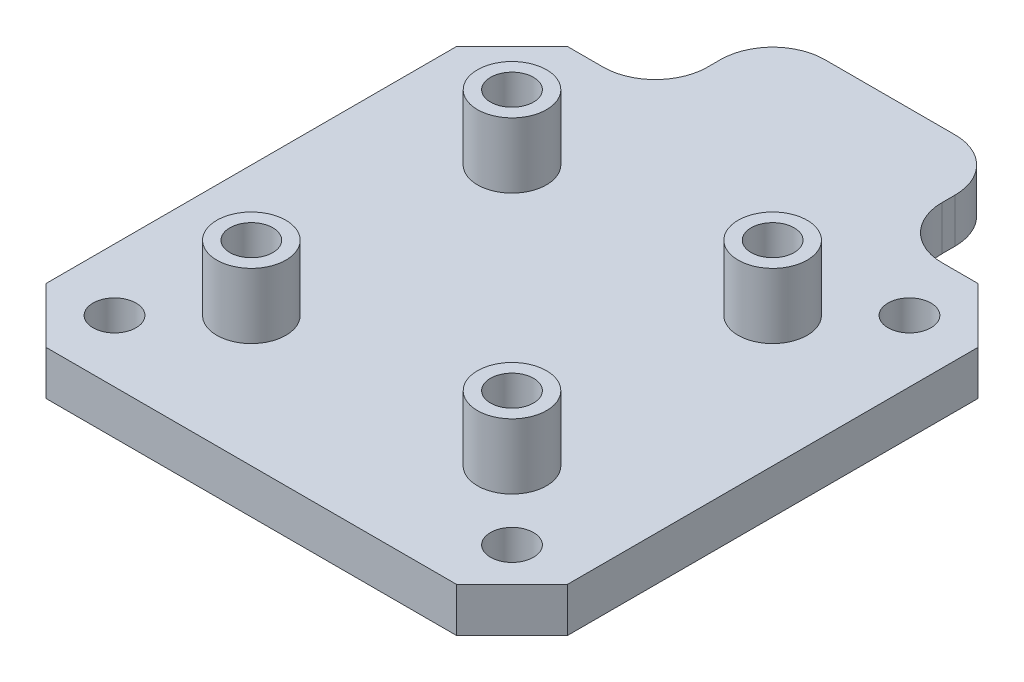
from build123d import *

# Parameters (mm, degrees)
BOSS_EXTRUDE1_DEPTH = 1.7
SKETCH2_R           = 1.65
CUT_EXTRUDE1_DEPTH  = 3.4
BOSS_EXTRUDE2_START = 5
SKETCH3_R           = 2.65
SKETCH3_R_2         = 1.65
BOSS_EXTRUDE2_DEPTH = 5
CUT_EXTRUDE2_START  = -0.5
CUT_EXTRUDE2_DEPTH  = 2.4


with BuildPart() as part:
    # Sketch1 → Boss-Extrude1 (new, symmetric)
    with BuildSketch(Plane(origin=(0, 0, 0), x_dir=(1, 0, 0), z_dir=(0, 1, 0))):
        with BuildLine():
            Line((-13, 20), (-15.757359313, 20))
            Line((-15.757359313, 20), (-20, 15.757359313))
            Line((-20, 15.757359313), (-20, -15.757359313))
            Line((-20, -15.757359313), (-15.757359313, -20))
            Line((-15.757359313, -20), (15.757359313, -20))
            Line((15.757359313, -20), (20, -15.757359313))
            Line((20, -15.757359313), (20, 15.757359313))
            Line((20, 15.757359313), (15.757359313, 20))
            Line((15.757359313, 20), (13, 20))
            ThreePointArc((13, 20), (10.171572875, 21.171572875), (9, 24))
            Line((9, 24), (9, 25))
            ThreePointArc((9, 25), (7.828427125, 27.828427125), (5, 29))
            Line((5, 29), (-5, 29))
            ThreePointArc((-5, 29), (-7.828427125, 27.828427125), (-9, 25))
            Line((-9, 25), (-9, 24))
            ThreePointArc((-9, 24), (-10.171572875, 21.171572875), (-13, 20))
        make_face()
    extrude(amount=BOSS_EXTRUDE1_DEPTH, both=True)

    # Sketch2 → Cut-Extrude1 (cut)
    with BuildSketch(Plane(origin=(0, 1.7, 0), x_dir=(1, 0, 0), z_dir=(0, 1, 0))):
        with Locations(Location((-10, 10, 0), (0, 0, 270))):
            Circle(SKETCH2_R)
        with Locations(Location((10, 10, 0), (0, 0, 270))):
            Circle(SKETCH2_R)
        with Locations(Location((-10, -10, 0), (0, 0, 270))):
            Circle(SKETCH2_R)
        with Locations(Location((10, -10, 0), (0, 0, 270))):
            Circle(SKETCH2_R)
        with Locations(Location((-15.25, -15.25, 0), (0, 0, 270))):
            Circle(SKETCH2_R)
        with Locations(Location((-15.25, 15.25, 0), (0, 0, 270))):
            Circle(SKETCH2_R)
        with Locations(Location((15.25, 15.25, 0), (0, 0, 270))):
            Circle(SKETCH2_R)
        with Locations(Location((15.25, -15.25, 0), (0, 0, 270))):
            Circle(SKETCH2_R)
    extrude(amount=-CUT_EXTRUDE1_DEPTH, mode=Mode.SUBTRACT)

    # Sketch3 → Boss-Extrude2 (add)
    # profile 1 of 4: a face of its own
    with BuildSketch(Plane(origin=(0, 1.7, 0), x_dir=(1, 0, 0), z_dir=(0, 1, 0)).offset(BOSS_EXTRUDE2_START)):
        with Locations(Location((-10, 10, 0), (0, 0, 270))):
            Circle(SKETCH3_R)
        with Locations(Location((-10, 10, 0), (0, 0, 270))):
            Circle(SKETCH3_R_2, mode=Mode.SUBTRACT)
    # profile 2 of 4: a face of its own
    with BuildSketch(Plane(origin=(0, 1.7, 0), x_dir=(1, 0, 0), z_dir=(0, 1, 0)).offset(BOSS_EXTRUDE2_START)):
        with Locations(Location((10, 10, 0), (0, 0, 270))):
            Circle(SKETCH3_R)
        with Locations(Location((10, 10, 0), (0, 0, 270))):
            Circle(SKETCH3_R_2, mode=Mode.SUBTRACT)
    # profile 3 of 4: a face of its own
    with BuildSketch(Plane(origin=(0, 1.7, 0), x_dir=(1, 0, 0), z_dir=(0, 1, 0)).offset(BOSS_EXTRUDE2_START)):
        with Locations(Location((10, -10, 0), (0, 0, 270))):
            Circle(SKETCH3_R)
        with Locations(Location((10, -10, 0), (0, 0, 270))):
            Circle(SKETCH3_R_2, mode=Mode.SUBTRACT)
    # profile 4 of 4: a face of its own
    with BuildSketch(Plane(origin=(0, 1.7, 0), x_dir=(1, 0, 0), z_dir=(0, 1, 0)).offset(BOSS_EXTRUDE2_START)):
        with Locations(Location((-10, -10, 0), (0, 0, 270))):
            Circle(SKETCH3_R)
        with Locations(Location((-10, -10, 0), (0, 0, 270))):
            Circle(SKETCH3_R_2, mode=Mode.SUBTRACT)
    extrude(amount=-BOSS_EXTRUDE2_DEPTH)

    # Sketch4 → Cut-Extrude2 (cut)
    with BuildSketch(Plane(origin=(0, 1.7, 0), x_dir=(1, 0, 0), z_dir=(0, 1, 0)).offset(CUT_EXTRUDE2_START)):
        Polygon((-6.709103466, 10), (-8.354551733, 12.85), (-11.645448267, 12.85), (-13.290896534, 10), (-11.645448267, 7.15), (-8.354551733, 7.15), align=None)
        Polygon((13.290896534, 10), (11.645448267, 12.85), (8.354551733, 12.85), (6.709103466, 10), (8.354551733, 7.15), (11.645448267, 7.15), align=None)
        Polygon((13.290896534, -10), (11.645448267, -7.15), (8.354551733, -7.15), (6.709103466, -10), (8.354551733, -12.85), (11.645448267, -12.85), align=None)
        Polygon((-6.709103466, -10), (-8.354551733, -7.15), (-11.645448267, -7.15), (-13.290896534, -10), (-11.645448267, -12.85), (-8.354551733, -12.85), align=None)
    extrude(amount=-CUT_EXTRUDE2_DEPTH, mode=Mode.SUBTRACT)


solid = part.part
